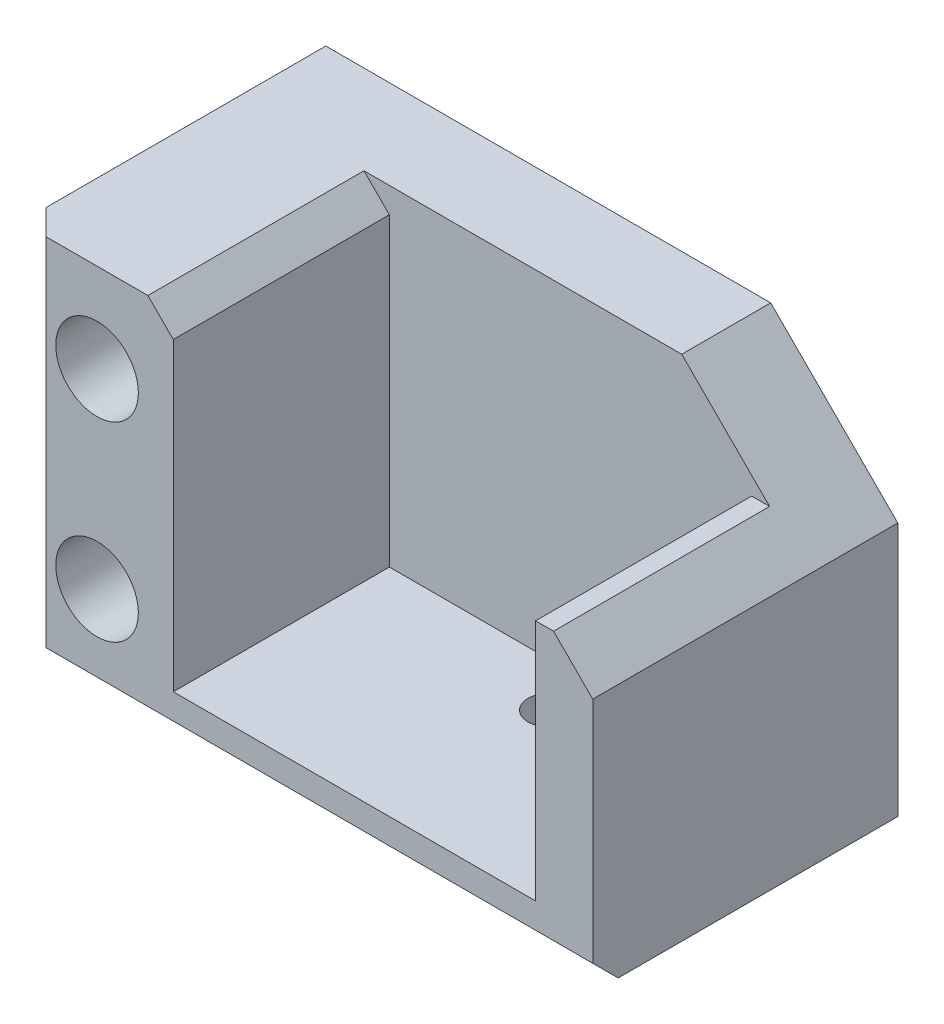
from build123d import *

# Parameters (mm, degrees)
SKETCH_1_W                  = 45
SKETCH_1_H                  = 30
EXTRUDE_1_DEPTH             = 24
SKETCH_2_W                  = 17
SKETCH_2_H                  = 6.914213562
CUT_EXTRUDE_1_DEPTH         = 33
CUT_EXTRUDE_2_REACH         = 62.975
SKETCH_4_W                  = 28.5
SKETCH_4_H                  = 17
HOLE_WIZARD_3_2_3_2_1_D     = 3.2
HOLE_WIZARD_3_2_3_2_2_D     = 3.2
HOLE_WIZARD_M31_D           = 3.4
HOLE_WIZARD_M31_CBORE_D     = 6.5
HOLE_WIZARD_M31_CBORE_DEPTH = 15
CHAMFER_1_SIZE              = 2
CHAMFER_2_SIZE              = 10


with BuildPart() as part:
    # Эскиз1 → Бобышка-Вытянуть1 (new body)
    with BuildSketch(Plane.XY.offset(21)):
        with Locations((28.500002027, 21)):
            Rectangle(SKETCH_1_W, SKETCH_1_H)
    extrude(amount=-EXTRUDE_1_DEPTH)

    # Эскиз2 → Вырез-Вытянуть1 (cut)
    with BuildSketch(Plane(origin=(51.000002027, 0, 0), x_dir=(0, 0, -1), z_dir=(1, 0, 0))):
        with Locations((-12.5, 32.542893219)):
            Rectangle(SKETCH_2_W, SKETCH_2_H)
    extrude(amount=-CUT_EXTRUDE_1_DEPTH, mode=Mode.SUBTRACT)

    # Эскиз4 → Вырез-Вытянуть2 (cut, up to next)
    with BuildSketch(Plane.XZ.offset(-10), mode=Mode.PRIVATE) as cut_extrude_2_sk1:
        with Locations((32.250002027, 12.5)):
            Rectangle(SKETCH_4_W, SKETCH_4_H)
    cut_extrude_2_tool1 = extrude(cut_extrude_2_sk1.sketch, amount=-CUT_EXTRUDE_2_REACH, mode=Mode.PRIVATE) & part.part
    add(cut_extrude_2_tool1.solids().sort_by_distance((32.250002, 10, 12.5))[0], mode=Mode.SUBTRACT)

    # Диаметр отверстия Ø3.2 (3.2)1 (through all)
    with Locations(Plane.XY.offset(4)):
        with Locations((42.000002027, 14)):
            Hole(HOLE_WIZARD_3_2_3_2_1_D / 2)

    # Диаметр отверстия Ø3.2 (3.2)2 (through all)
    with Locations(Plane(origin=(0, 10, 0), x_dir=(1, 0, 0), z_dir=(0, 1, 0))):
        with Locations((34.000002027, -7.5)):
            Hole(HOLE_WIZARD_3_2_3_2_2_D / 2)

    # Цековка для винта с заклепочной головкой M31 (through all)
    with Locations(Plane.XY.offset(21)):
        with Locations((12.000002027, 29), (12.000002027, 14)):
            CounterBoreHole(HOLE_WIZARD_M31_D / 2, HOLE_WIZARD_M31_CBORE_D / 2, HOLE_WIZARD_M31_CBORE_DEPTH)

    # Фаска1
    chamfer_1_edges = [part.edges().sort_by_distance(p)[0] for p in [
        (18.000002027, 36, 12.5),
        (6.000002027, 21, 21),
        (28.500002027, 6, 21),
    ]]
    chamfer(chamfer_1_edges, length=CHAMFER_1_SIZE)

    # Фаска2
    chamfer_2_edges = [part.edges().sort_by_distance(p)[0] for p in [
        (51.000002027, 36, 0.5),
    ]]
    chamfer(chamfer_2_edges, length=CHAMFER_2_SIZE)


solid = part.part
